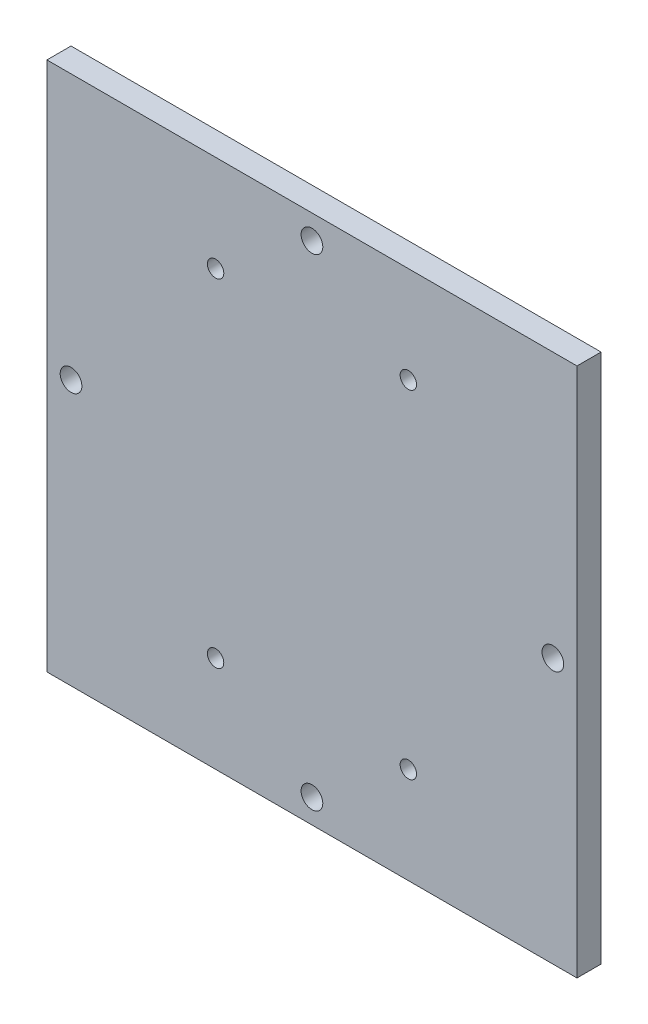
from build123d import *

# Parameters (mm, degrees)
SKIZZE1_W                       = 220
SKIZZE1_H                       = 220
AUFSATZ_LINEAR_AUSTRAGEN1_DEPTH = 10
SKIZZE3_R                       = 4.5
SCHNITT_LINEAR_AUSTRAGEN1_DEPTH = 156.884572681
SKIZZE4_R                       = 3.4
SCHNITT_LINEAR_AUSTRAGEN2_DEPTH = 156.884572681


with BuildPart() as part:
    # Skizze1 → Aufsatz-Linear austragen1 (new body)
    with BuildSketch(Plane.XY):
        Rectangle(SKIZZE1_W, SKIZZE1_H)
    extrude(amount=AUFSATZ_LINEAR_AUSTRAGEN1_DEPTH)

    # Skizze3 → Schnitt-Linear austragen1 (cut, through all)
    with BuildSketch(Plane.XY.offset(10)):
        with Locations((100, 0)):
            Circle(SKIZZE3_R)
        with Locations((0, -100)):
            Circle(SKIZZE3_R)
        with Locations((-100, 0)):
            Circle(SKIZZE3_R)
        with Locations((0, 100)):
            Circle(SKIZZE3_R)
    extrude(amount=-SCHNITT_LINEAR_AUSTRAGEN1_DEPTH, mode=Mode.SUBTRACT)

    # Skizze4 → Schnitt-Linear austragen2 (cut, through all)
    with BuildSketch(Plane.XY.offset(10)):
        with Locations((40, 70)):
            Circle(SKIZZE4_R)
        with Locations(Location((-40, 70, 0), (0, 0, 180))):
            Circle(SKIZZE4_R)
        with Locations(Location((40, -70, 0), (0, 0, 180))):
            Circle(SKIZZE4_R)
        with Locations((-40, -70)):
            Circle(SKIZZE4_R)
    extrude(amount=-SCHNITT_LINEAR_AUSTRAGEN2_DEPTH, mode=Mode.SUBTRACT)


solid = part.part
